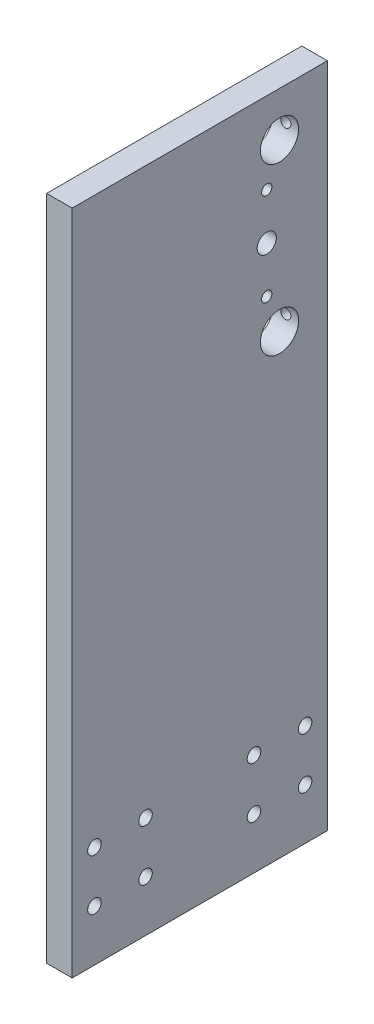
from build123d import *

# Parameters (mm, degrees)
SKETCH1_W                             = 127
SKETCH1_H                             = 331.7875
BOSS_EXTRUDE1_DEPTH                   = 12.7
SKETCH9_R                             = 9.525
SKETCH9_R_2                           = 4.7625
CUT_EXTRUDE1_DEPTH                    = 339.048051549
CUT_EXTRUDE3_DEPTH                    = 3.175
F_10_CLEARANCE_HOLE2_D                = 5.1054
TAPPED_HOLE_FOR_10_32_HELICOIL1_D     = 5.1054
TAPPED_HOLE_FOR_10_32_HELICOIL1_DEPTH = 31.75
TAPPED_HOLE_FOR_10_32_HELICOIL1_TIP   = 1.533816902
F_1_4_CLEARANCE_HOLE1_D               = 6.7564


with BuildPart() as part:
    # Sketch1 → Boss-Extrude1 (new body)
    with BuildSketch(Plane(origin=(0, 0, 0), x_dir=(0, 0, -1), z_dir=(1, 0, 0))):
        with Locations((0, 165.89375)):
            Rectangle(SKETCH1_W, SKETCH1_H)
    extrude(amount=BOSS_EXTRUDE1_DEPTH)

    # Sketch9 → Cut-Extrude1 (cut, through all)
    with BuildSketch(Plane(origin=(12.7, 0, 0), x_dir=(0, 0, -1), z_dir=(1, 0, 0))):
        with Locations((39.6875, 309.5625)):
            Circle(SKETCH9_R)
        with Locations((39.6875, 227.0125)):
            Circle(SKETCH9_R)
        with Locations((33.3375, 268.2875)):
            Circle(SKETCH9_R_2)
    extrude(amount=-CUT_EXTRUDE1_DEPTH, mode=Mode.SUBTRACT)

    # Sketch24 → Cut-Extrude3 (cut)
    with BuildSketch(Plane.ZY):
        with BuildLine():
            Line((-42.8625, 296.8625), (-23.8125, 296.8625))
            ThreePointArc((-23.8125, 296.8625), (-19.322371939, 295.002628061), (-17.4625, 290.5125))
            Line((-17.4625, 290.5125), (-17.4625, 246.0625))
            ThreePointArc((-17.4625, 246.0625), (-19.322371939, 241.572371939), (-23.8125, 239.7125))
            Line((-23.8125, 239.7125), (-42.8625, 239.7125))
            ThreePointArc((-42.8625, 239.7125), (-47.352628061, 241.572371939), (-49.2125, 246.0625))
            Line((-49.2125, 246.0625), (-49.2125, 290.5125))
            ThreePointArc((-49.2125, 290.5125), (-47.352628061, 295.002628061), (-42.8625, 296.8625))
        make_face()
    extrude(amount=-CUT_EXTRUDE3_DEPTH, mode=Mode.SUBTRACT)

    # #10 Clearance Hole2 (through all)
    with Locations(Plane.ZY.offset(-3.175)):
        with Locations((-33.3375, 291.2999), (-33.3375, 245.2751)):
            Hole(F_10_CLEARANCE_HOLE2_D / 2)

    # Tapped Hole for #10-32 Helicoil1
    with Locations(Plane(origin=(0, 0, -63.5), x_dir=(-1, 0, 0), z_dir=(0, 0, -1))):
        with Locations((-6.35, 325.4375), (-6.35, 211.1375), (-6.35, 309.5625), (-6.35, 227.0125)):
            Hole(TAPPED_HOLE_FOR_10_32_HELICOIL1_D / 2, depth=TAPPED_HOLE_FOR_10_32_HELICOIL1_DEPTH)
            with Locations((0, 0, -(TAPPED_HOLE_FOR_10_32_HELICOIL1_DEPTH + TAPPED_HOLE_FOR_10_32_HELICOIL1_TIP / 2))):  # 118° drill point
                Cone(0, TAPPED_HOLE_FOR_10_32_HELICOIL1_D / 2, TAPPED_HOLE_FOR_10_32_HELICOIL1_TIP, mode=Mode.SUBTRACT)

    # 1/4 Clearance Hole1 (through all)
    with Locations(Plane(origin=(12.7, 0, 0), x_dir=(0, 0, -1), z_dir=(1, 0, 0))):
        with Locations((-52.3875, 25.4), (-26.9875, 50.8), (-52.3875, 50.8), (-26.9875, 25.4), (26.9875, 50.8), (52.3875, 25.4), (26.9875, 25.4), (52.3875, 50.8)):
            Hole(F_1_4_CLEARANCE_HOLE1_D / 2)


solid = part.part
